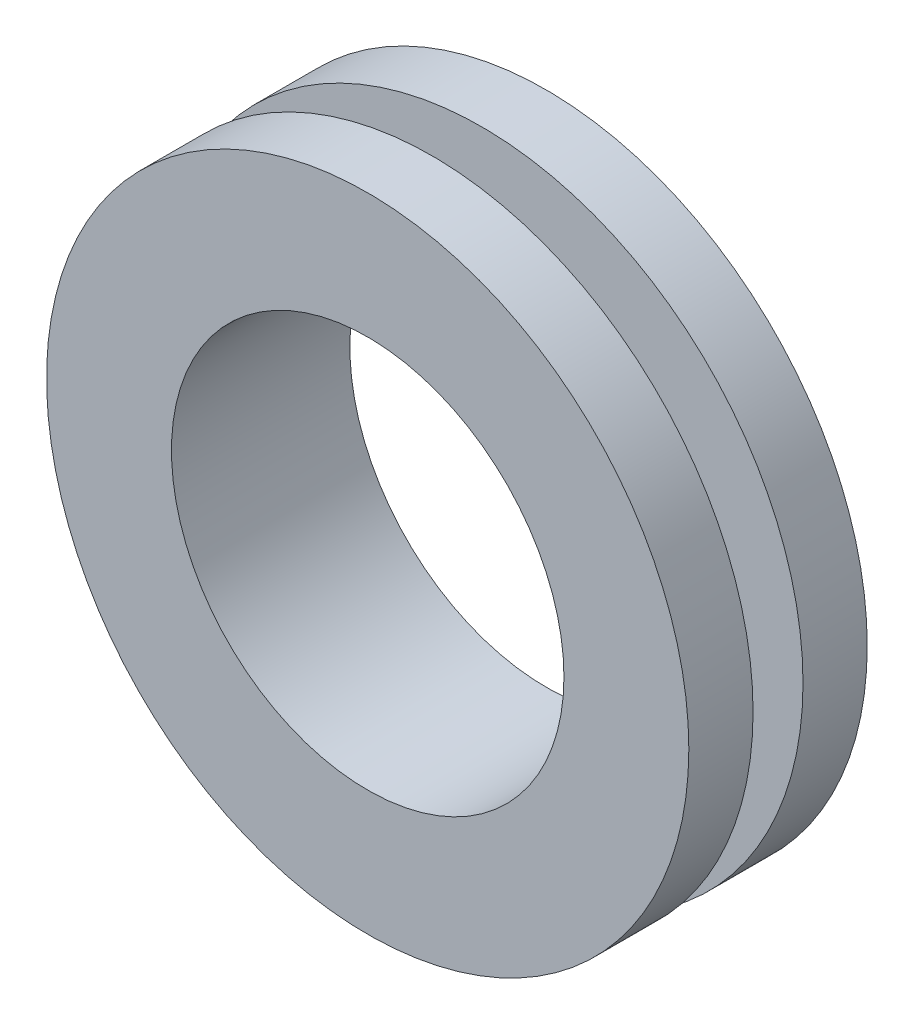
from build123d import *

# Parameters (mm, degrees)
SKETCH1_R           = 45
BOSS_EXTRUDE1_DEPTH = 9
SKETCH2_R           = 32.5
BOSS_EXTRUDE4_DEPTH = 7
SKETCH4_R           = 45
BOSS_EXTRUDE5_DEPTH = 9
SKETCH5_R           = 27.5
CUT_EXTRUDE1_DEPTH  = 25


with BuildPart() as part:
    # Sketch1 → Boss-Extrude1 (new body)
    with BuildSketch(Plane.XY):
        Circle(SKETCH1_R)
    extrude(amount=BOSS_EXTRUDE1_DEPTH)

    # Sketch2 → Boss-Extrude4 (add)
    with BuildSketch(Plane.XY.offset(9)):
        Circle(SKETCH2_R)
    extrude(amount=BOSS_EXTRUDE4_DEPTH)

    # Sketch4 → Boss-Extrude5 (add)
    with BuildSketch(Plane.XY.offset(16)):
        Circle(SKETCH4_R)
    extrude(amount=BOSS_EXTRUDE5_DEPTH)

    # Sketch5 → Cut-Extrude1 (cut)
    with BuildSketch(Plane.XY.offset(25)):
        Circle(SKETCH5_R)
    extrude(amount=-CUT_EXTRUDE1_DEPTH, mode=Mode.SUBTRACT)


solid = part.part
